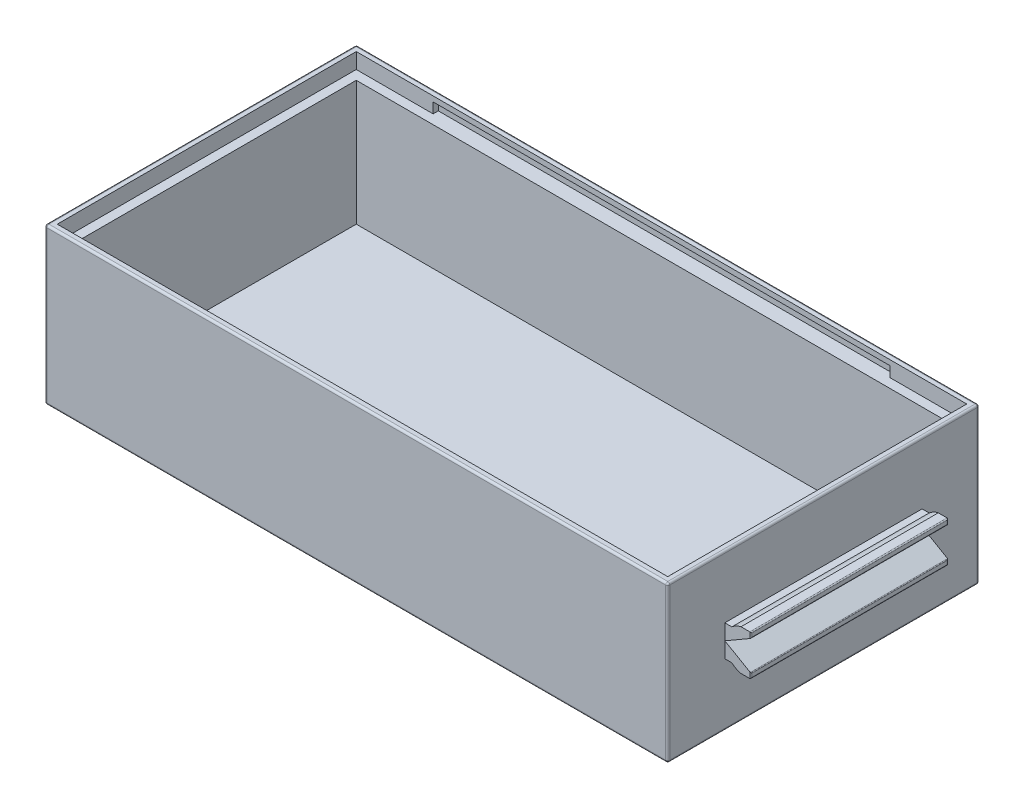
from build123d import *

# Parameters (mm, degrees)
SKETCH_1_W             = 60
SKETCH_1_H             = 30
EXTRUDE_1_DEPTH        = 15
SKETCH_2_W             = 58.8
SKETCH_2_H             = 28.8
CUT_EXTRUDE_2_DEPTH    = 1.5
SKETCH_4_W             = 57
SKETCH_4_H             = 27
CUT_EXTRUDE_3_DEPTH    = 12
SKETCH_5_W             = 44
SKETCH_5_H             = 1
CUT_EXTRUDE_4_DEPTH    = 0.5
EXTRUDE_START          = -5.5
EXTRUDE_4_DEPTH        = 19
MIRROR_START           = -5.5
MIRROR_3_COPY_1_DEPTH  = 19
EXTRUDE_5_DEPTH        = 2
PATTERN_LINEAR_1_COUNT = 4
PATTERN_LINEAR_1_PITCH = 15
CUT_EXTRUDE_5_DEPTH    = 67.001893912
FILLET_1_R             = 0.2
FILLET_2_R             = 0.1


with BuildPart() as part:
    # 草图1 → 凸台-拉伸1 (new body)
    with BuildSketch(Plane(origin=(0, 0, 0), x_dir=(1, 0, 0), z_dir=(0, 1, 0))):
        Rectangle(SKETCH_1_W, SKETCH_1_H)
    extrude(amount=EXTRUDE_1_DEPTH)

    # 草图2 → 切除-拉伸2 (cut)
    with BuildSketch(Plane(origin=(0, 15, 0), x_dir=(1, 0, 0), z_dir=(0, 1, 0))):
        Rectangle(SKETCH_2_W, SKETCH_2_H)
    extrude(amount=-CUT_EXTRUDE_2_DEPTH, mode=Mode.SUBTRACT)

    # 草图4 → 切除-拉伸3 (cut)
    with BuildSketch(Plane(origin=(0, 13.5, 0), x_dir=(1, 0, 0), z_dir=(0, 1, 0))):
        Rectangle(SKETCH_4_W, SKETCH_4_H)
    extrude(amount=-CUT_EXTRUDE_3_DEPTH, mode=Mode.SUBTRACT)

    # 草图5 → 切除-拉伸4 (cut)
    with BuildSketch(Plane.XY.offset(-14.4)):
        with Locations((0, 14)):
            Rectangle(SKETCH_5_W, SKETCH_5_H)
    cut_extrude_4 = extrude(amount=-CUT_EXTRUDE_4_DEPTH, mode=Mode.SUBTRACT)

    # 镜向1: 切除-拉伸4 across plane
    add(cut_extrude_4.mirror(Plane.XY), mode=Mode.SUBTRACT)

    # 草图6 → 凸台-拉伸4 (add)
    with BuildSketch(Plane.XY.offset(15).offset(EXTRUDE_START)):
        with BuildLine():
            Line((30, 7.5), (30, 9))
            Line((30, 9), (30.677124344, 9))
            ThreePointArc((30.677124344, 9), (31.088161527, 9.280042303), (31.555590279, 9.45))
            Line((31.555590279, 9.45), (32.5, 9.45))
            Line((32.5, 9.45), (32.5, 8.943375673))
            Line((32.5, 8.943375673), (30, 7.5))
        make_face()
    extrude_4 = extrude(amount=-EXTRUDE_4_DEPTH)

    # 镜向2: 凸台-拉伸4 across plane
    add(extrude_4.mirror(Plane(origin=(0, 7.5, 0), x_dir=(0, 0, 1), z_dir=(0, -1, 0))))

    # 镜向3: 凸台-拉伸4 across plane
    add(extrude_4.mirror(Plane(origin=(0, 0, 0), x_dir=(0, 0, 1), z_dir=(1, 0, 0))))

    # 镜向3 copy 1 sketch → 镜向3 copy 1 (add)
    with BuildSketch(Plane(origin=(0, 15, 15), x_dir=(-1, 0, 0), z_dir=(0, 0, 1)).offset(MIRROR_START)):
        with BuildLine():
            Line((30, 7.5), (30, 9))
            Line((30, 9), (30.677124344, 9))
            ThreePointArc((30.677124344, 9), (31.088161527, 9.280042303), (31.555590279, 9.45))
            Line((31.555590279, 9.45), (32.5, 9.45))
            Line((32.5, 9.45), (32.5, 8.943375673))
            Line((32.5, 8.943375673), (30, 7.5))
        make_face()
    extrude(amount=-MIRROR_3_COPY_1_DEPTH)

    # 草图7 → 凸台-拉伸5 (add, symmetric)
    with BuildSketch(Plane.XY):
        with BuildLine():
            Line((-24, 0), (-21, 0))
            Line((-21, 0), (-21, -0.677124344))
            ThreePointArc((-21, -0.677124344), (-20.719957697, -1.088161527), (-20.55, -1.555590279))
            Line((-20.55, -1.555590279), (-20.55, -2.5))
            Line((-20.55, -2.5), (-24.45, -2.5))
            Line((-24.45, -2.5), (-24.45, -1.555590279))
            ThreePointArc((-24.45, -1.555590279), (-24.280042303, -1.088161527), (-24, -0.677124344))
            Line((-24, -0.677124344), (-24, 0))
        make_face()
    extrude_5 = extrude(amount=EXTRUDE_5_DEPTH, both=True)

    # 阵列(线性)1: 凸台-拉伸5 ×4
    with Locations(*[(i * PATTERN_LINEAR_1_PITCH, 0, 0) for i in range(1, PATTERN_LINEAR_1_COUNT)]):
        add(extrude_5)

    # 草图8 → 切除-拉伸5 (cut, through all)
    with BuildSketch(Plane.ZY.offset(30)):
        with BuildLine():
            Line((1.5, 0), (1.5, -0.677124344))
            ThreePointArc((1.5, -0.677124344), (1.780042303, -1.088161527), (1.95, -1.555590279))
            Line((1.95, -1.555590279), (1.95, -2.5))
            Line((1.95, -2.5), (2, -2.5))
            Line((2, -2.5), (2, 0))
            Line((2, 0), (1.5, 0))
        make_face()
        with BuildLine():
            Line((-2, 0), (-1.5, 0))
            Line((-1.5, 0), (-1.5, -0.677124344))
            ThreePointArc((-1.5, -0.677124344), (-1.780042303, -1.088161527), (-1.95, -1.555590279))
            Line((-1.95, -1.555590279), (-1.95, -2.5))
            Line((-1.95, -2.5), (-2, -2.5))
            Line((-2, -2.5), (-2, 0))
        make_face()
    extrude(amount=-CUT_EXTRUDE_5_DEPTH, mode=Mode.SUBTRACT)

    # 圆角1
    fillet_1_edges = [part.edges().sort_by_distance(p)[0] for p in [
        (0, 15, 15),
        (30, 15, 0),
        (0, 15, -15),
        (30, 0, 0),
        (0, 0, 15),
        (-30, 0, 0),
        (0, 0, -15),
        (-30, 15, 0),
        (30, 7.5, -15),
        (30, 7.5, 15),
        (-30, 7.5, 15),
        (-30, 7.5, -15),
    ]]
    fillet(fillet_1_edges, radius=FILLET_1_R)

    # 圆角2
    fillet_2_edges = [part.edges().sort_by_distance(p)[0] for p in [
        (-32.5, 9.45, 0),
        (-32.5, 9.196687836, -9.5),
        (-32.5, 6.056624327, 0),
        (-32.5, 5.803312164, -9.5),
        (-32.5, 5.55, 0),
        (-32.5, 5.803312164, 9.5),
        (24.45, -2.5, 0),
        (20.55, -2.5, 0),
        (9.45, -2.5, 0),
        (5.55, -2.5, 0),
        (-5.55, -2.5, 0),
        (-9.45, -2.5, 0),
        (-20.55, -2.5, 0),
        (-24.45, -2.5, 0),
        (-22.5, -2.5, -1.95),
        (-7.5, -2.5, -1.95),
        (7.5, -2.5, -1.95),
        (22.5, -2.5, -1.95),
        (-22.5, -2.5, 1.95),
        (-7.5, -2.5, 1.95),
        (7.5, -2.5, 1.95),
        (22.5, -2.5, 1.95),
        (32.5, 8.943375673, 0),
        (32.5, 9.196687836, -9.5),
        (32.5, 9.45, 0),
        (32.5, 9.196687836, 9.5),
        (32.5, 5.803312164, 9.5),
        (32.5, 6.056624327, 0),
        (32.5, 5.55, 0),
        (32.5, 5.803312164, -9.5),
        (-32.5, 9.196687836, 9.5),
        (-32.5, 8.943375673, 0),
    ]]
    fillet(fillet_2_edges, radius=FILLET_2_R)


solid = part.part
